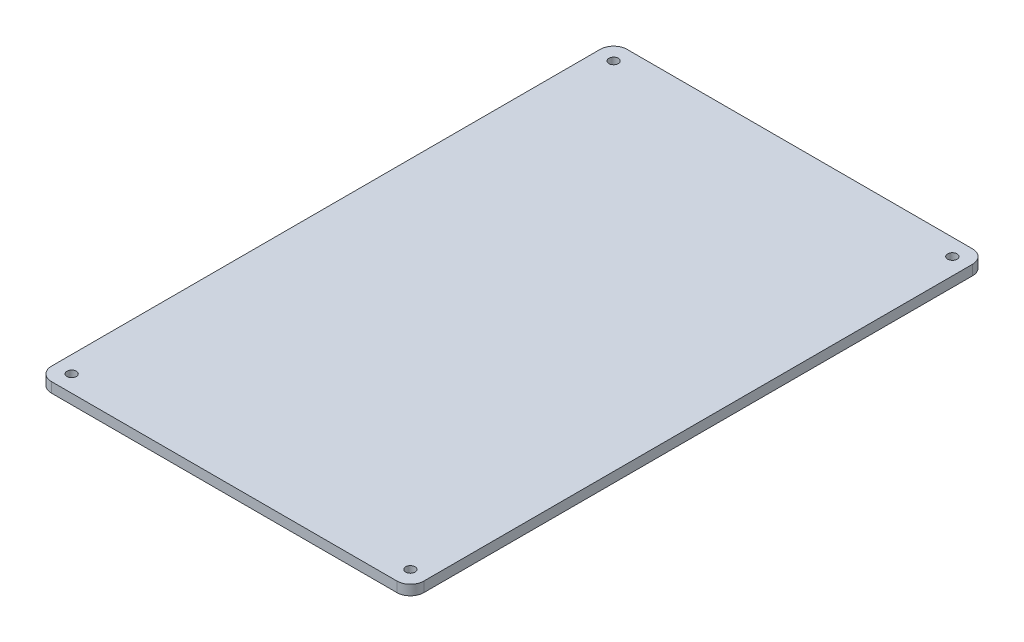
from build123d import *

# Parameters (mm, degrees)
SKETCH1_R           = 1.4
BOSS_EXTRUDE1_DEPTH = 3


with BuildPart() as part:
    # Sketch1 → Boss-Extrude1 (new body)
    with BuildSketch(Plane(origin=(0, 0, 0), x_dir=(1, 0, 0), z_dir=(0, 1, 0))):
        with BuildLine():
            ThreePointArc((-55.5, 80.578962649), (-54.328427125, 83.407389773), (-51.5, 84.578962649))
            Line((-51.5, 84.578962649), (51.5, 84.578962649))
            ThreePointArc((51.5, 84.578962649), (54.328427125, 83.407389773), (55.5, 80.578962649))
            Line((55.5, 80.578962649), (55.5, -83.017769116))
            ThreePointArc((55.5, -83.017769116), (54.328427125, -85.846196241), (51.5, -87.017769116))
            Line((51.5, -87.017769116), (-51.5, -87.017769116))
            ThreePointArc((-51.5, -87.017769116), (-54.328427125, -85.846196241), (-55.5, -83.017769116))
            Line((-55.5, -83.017769116), (-55.5, 80.578962649))
        make_face()
        with Locations(Location((-50.5, 79.578962649, 0), (0, 0, 270))):
            Circle(SKETCH1_R, mode=Mode.SUBTRACT)
        with Locations(Location((50.5, 79.578962649, 0), (0, 0, 270))):
            Circle(SKETCH1_R, mode=Mode.SUBTRACT)
        with Locations(Location((50.5, -82.017769116, 0), (0, 0, 270))):
            Circle(SKETCH1_R, mode=Mode.SUBTRACT)
        with Locations(Location((-50.5, -82.017769116, 0), (0, 0, 270))):
            Circle(SKETCH1_R, mode=Mode.SUBTRACT)
    extrude(amount=BOSS_EXTRUDE1_DEPTH)


solid = part.part
